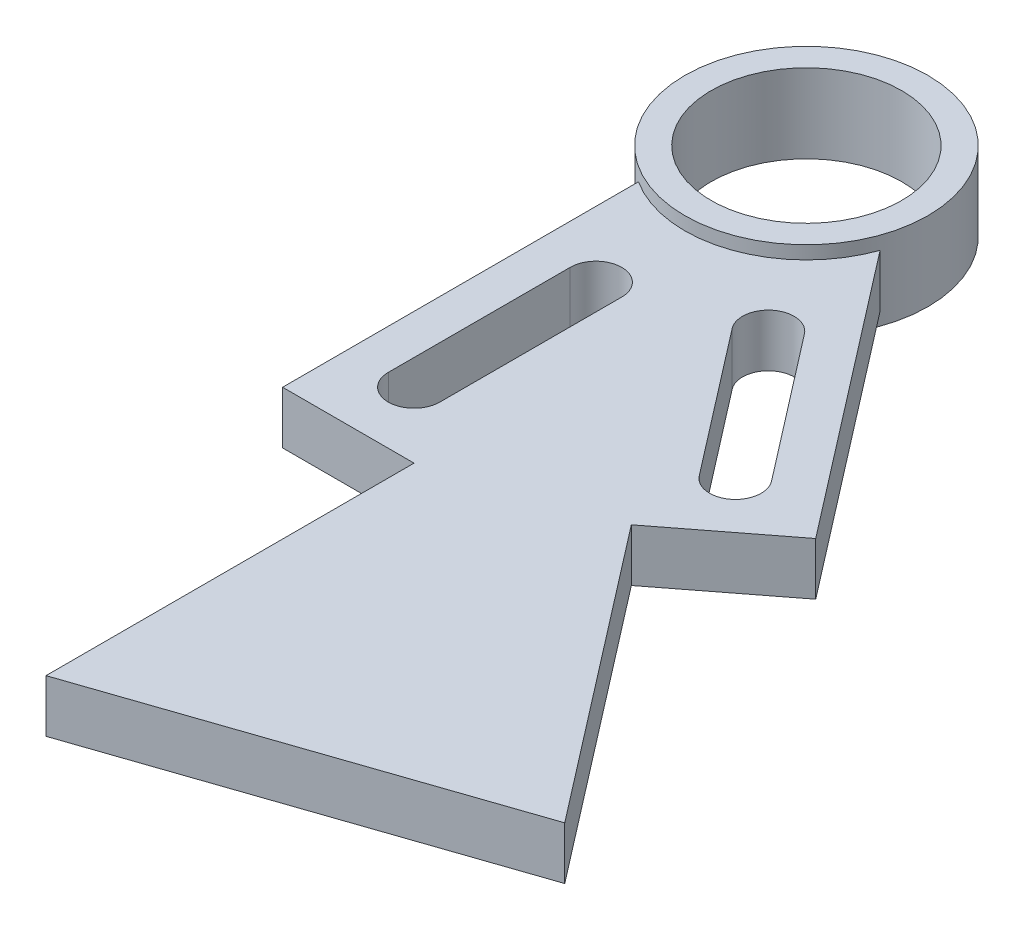
from build123d import *

# Parameters (mm, degrees)
SKETCH1_R             = 11.5062
BEARING_EXTRUDE_DEPTH = 4.7625
BOSS_EXTRUDE2_DEPTH   = 3.175


with BuildPart() as part:
    # Sketch1 → Bearing extrude (new, symmetric)
    with BuildSketch(Plane(origin=(0, 0, 0), x_dir=(1, 0, 0), z_dir=(0, 1, 0))):
        with BuildLine():
            ThreePointArc((14.6812, 0), (-7.035822924, 12.885450292), (-7.9375, -12.350454534))
            ThreePointArc((-7.9375, -12.350454534), (4.737240469, -13.895905375), (13.828626786, -4.930184039))
            ThreePointArc((13.828626786, -4.930184039), (14.466486599, -2.501679223), (14.6812, 0))
        make_face()
        Circle(SKETCH1_R, mode=Mode.SUBTRACT)
    extrude(amount=BEARING_EXTRUDE_DEPTH, both=True)

    # Sketch1<5> → Boss-Extrude2 (add, symmetric)
    with BuildSketch(Plane(origin=(0, 0, 0), x_dir=(1, 0, 0), z_dir=(0, 1, 0))):
        with BuildLine():
            Line((-7.9375, -12.350454534), (-7.9375, -55.3212))
            Line((-7.9375, -55.3212), (7.9375, -55.3212))
            Line((7.9375, -55.3212), (7.9375, -99.7712))
            Line((7.9375, -99.7712), (54.658455113, -83.843601666))
            Line((54.658455113, -83.843601666), (27.50713628, -48.649733087))
            Line((27.50713628, -48.649733087), (33.791755669, -43.801283295))
            Line((33.791755669, -43.801283295), (40.076375058, -38.952833503))
            Line((40.076375058, -38.952833503), (13.828626786, -4.930184039))
            ThreePointArc((13.828626786, -4.930184039), (4.737240469, -13.895905375), (-7.9375, -12.350454534))
        make_face()
        with BuildLine():
            ThreePointArc((3.1115, -47.3837), (0, -50.4952), (-3.1115, -47.3837))
            Line((-3.1115, -47.3837), (-3.1115, -25.4127))
            ThreePointArc((-3.1115, -25.4127), (0, -22.3012), (3.1115, -25.4127))
            Line((3.1115, -25.4127), (3.1115, -47.3837))
        make_face(mode=Mode.SUBTRACT)
        with BuildLine():
            ThreePointArc((31.406876677, -35.616071587), (32.029235213, -37.914749808), (30.843898195, -39.980234706))
            ThreePointArc((30.843898195, -39.980234706), (28.545219974, -40.602593241), (26.479735076, -39.417256224))
            Line((26.479735076, -39.417256224), (13.059226053, -22.021429755))
            ThreePointArc((13.059226053, -22.021429755), (13.622204535, -17.657266636), (17.986367654, -18.220245118))
            Line((17.986367654, -18.220245118), (31.406876677, -35.616071587))
        make_face(mode=Mode.SUBTRACT)
    extrude(amount=BOSS_EXTRUDE2_DEPTH, both=True)


solid = part.part
